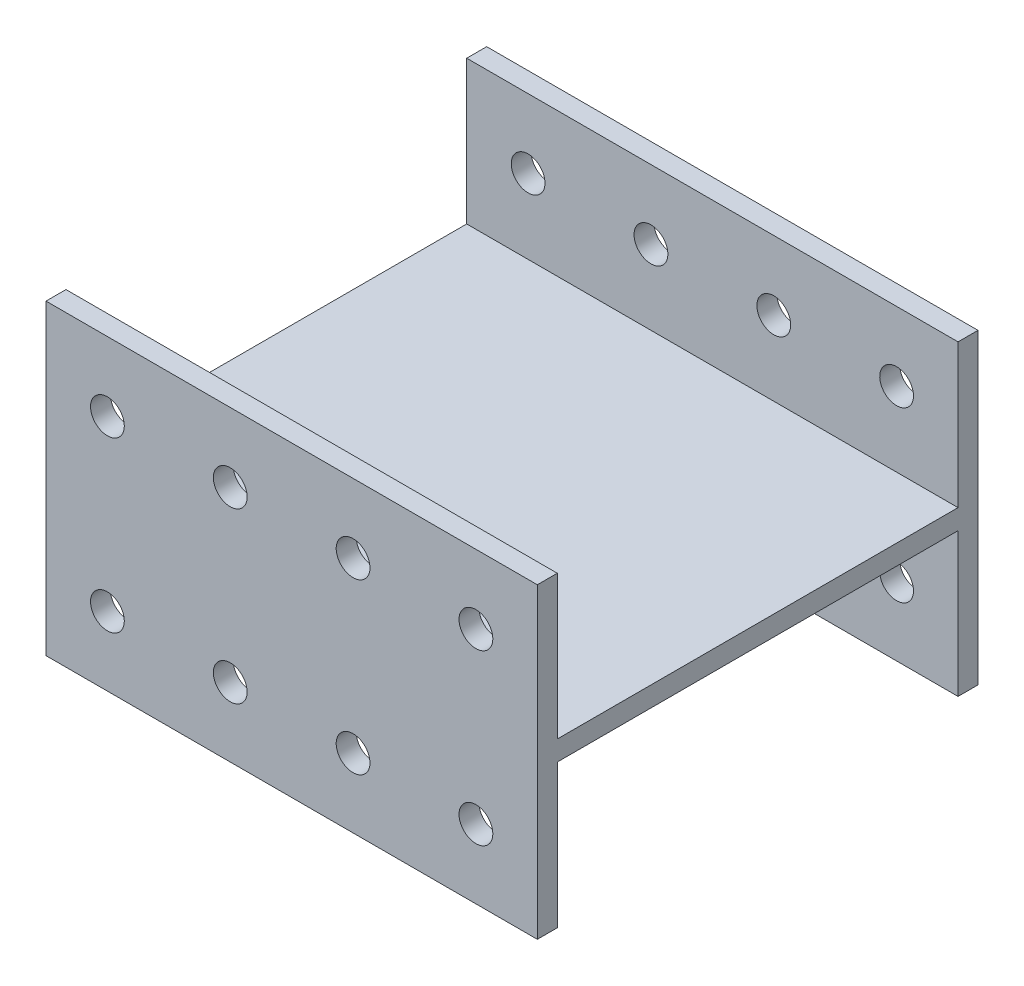
from build123d import *

# Parameters (mm, degrees)
SKETCH_1_W                  = 320
SKETCH_1_H                  = 200
EXTRUDE_1_DEPTH             = 287
SKETCH_2_R                  = 11
CUT_EXTRUDE_1_DEPTH         = 475.098091116
PATTERN_LINEAR_1_COUNT      = 4
PATTERN_LINEAR_1_PITCH      = 80
PATTERN_LINEAR_1_COUNT_DIR2 = 2
PATTERN_LINEAR_1_PITCH_DIR2 = 110
SKETCH_6_W                  = 261
SKETCH_6_H                  = 93.5
CUT_EXTRUDE_3_DEPTH         = 475.098091116


with BuildPart() as part:
    # 草图1 → 拉伸1 (new body)
    with BuildSketch(Plane.XY):
        with Locations((160, 100)):
            Rectangle(SKETCH_1_W, SKETCH_1_H)
    extrude(amount=EXTRUDE_1_DEPTH)

    # 草图2 → 切除-拉伸1 (cut, through all)
    with BuildSketch(Plane.XY.offset(287)):
        with Locations((40, 45)):
            Circle(SKETCH_2_R)
    cut_extrude_1 = extrude(amount=-CUT_EXTRUDE_1_DEPTH, mode=Mode.SUBTRACT)

    # 阵列(线性)1: Cut-Extrude 1 4 × 2
    with Locations(*[(i * PATTERN_LINEAR_1_PITCH, j * PATTERN_LINEAR_1_PITCH_DIR2, 0) for i in range(PATTERN_LINEAR_1_COUNT) for j in range(PATTERN_LINEAR_1_COUNT_DIR2) if (i, j) != (0, 0)]):
        add(cut_extrude_1, mode=Mode.SUBTRACT)

    # 草图6 → 切除-拉伸3 (cut, through all)
    with BuildSketch(Plane.ZY):
        with Locations((143.5, 153.25)):
            Rectangle(SKETCH_6_W, SKETCH_6_H)
        with Locations((143.5, 46.75)):
            Rectangle(SKETCH_6_W, SKETCH_6_H)
    extrude(amount=-CUT_EXTRUDE_3_DEPTH, mode=Mode.SUBTRACT)


solid = part.part
